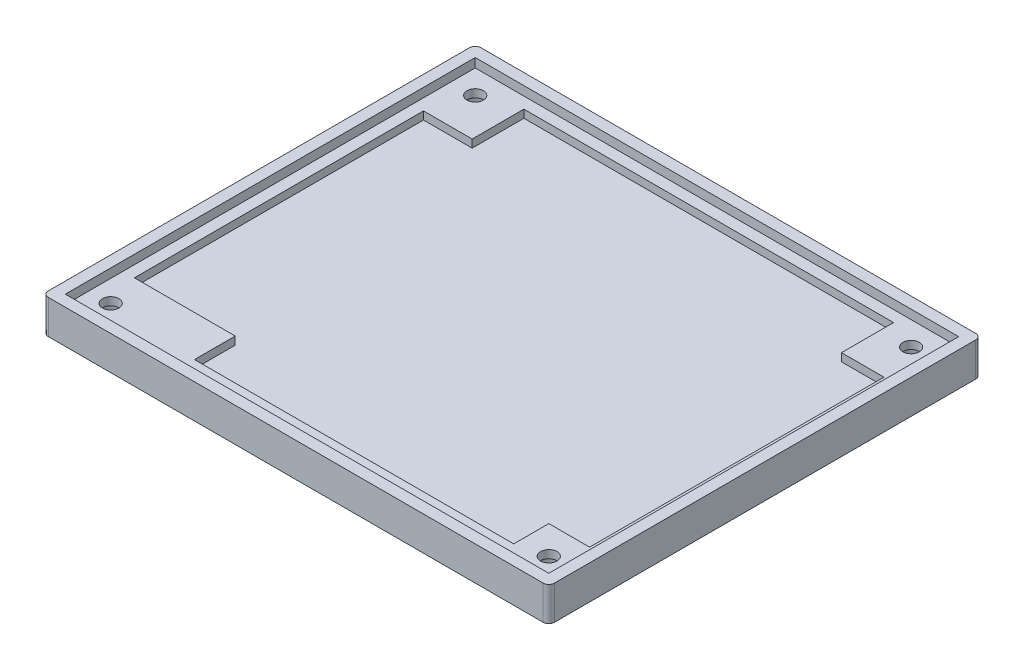
from build123d import *

# Parameters (mm, degrees)
SKETCH1_W           = 89.4
SKETCH1_H           = 76.4
BOSS_EXTRUDE1_DEPTH = 6
SKETCH1_5_W         = 85.4
SKETCH1_5_H         = 72.4
CUT_EXTRUDE2_DEPTH  = 1.6
CUT_EXTRUDE3_DEPTH  = 3
SKETCH1_7_R         = 1.45
CUT_EXTRUDE4_DEPTH  = 82.868794295
FILLET1_R           = 1
SKETCH2_R           = 3.5
CUT_EXTRUDE5_DEPTH  = 3


with BuildPart() as part:
    # Sketch1 → Boss-Extrude1 (new body)
    with BuildSketch(Plane(origin=(0, 0, 0), x_dir=(1, 0, 0), z_dir=(0, 1, 0))):
        with Locations((-24.890531337, 4.504302213)):
            Rectangle(SKETCH1_W, SKETCH1_H)
    extrude(amount=-BOSS_EXTRUDE1_DEPTH)

    # Sketch1<5> → Cut-Extrude2 (cut)
    with BuildSketch(Plane(origin=(0, 0, 0), x_dir=(1, 0, 0), z_dir=(0, 1, 0))):
        with Locations((-24.890531337, 4.504302213)):
            Rectangle(SKETCH1_5_W, SKETCH1_5_H)
    extrude(amount=-CUT_EXTRUDE2_DEPTH, mode=Mode.SUBTRACT)

    # Sketch1<6> → Cut-Extrude3 (cut)
    with BuildSketch(Plane(origin=(0, 0, 0), x_dir=(1, 0, 0), z_dir=(0, 1, 0))):
        Polygon((-47.775836727, -21.495697787), (-65.590531337, -21.495697787), (-65.590531337, 29.568169386), (-56.990531337, 29.568169386), (-56.990531337, 38.704302213), (8.309468663, 38.704302213), (8.309468663, 29.504302213), (15.809468663, 29.504302213), (15.809468663, -22.495697787), (8.609468663, -22.495697787), (8.609468663, -28.695697787), (-47.775836727, -28.695697787), align=None)
    extrude(amount=-CUT_EXTRUDE3_DEPTH, mode=Mode.SUBTRACT)

    # Sketch1<7> → Cut-Extrude4 (cut, through all)
    with BuildSketch(Plane(origin=(0, 0, 0), x_dir=(1, 0, 0), z_dir=(0, 1, 0))):
        with Locations((13.609468663, 36.504302213)):
            Circle(SKETCH1_7_R)
        with Locations((-63.775836727, -27.495697787)):
            Circle(SKETCH1_7_R)
        with Locations((-63.390531337, 36.504302213)):
            Circle(SKETCH1_7_R)
        with Locations((13.609468663, -27.495697787)):
            Circle(SKETCH1_7_R)
    extrude(amount=-CUT_EXTRUDE4_DEPTH, mode=Mode.SUBTRACT)

    # Fillet1
    fillet1_edges = [part.edges().sort_by_distance(p)[0] for p in [
        (-69.590531337, -3, 33.695697787),
        (-69.590531337, -3, -42.704302213),
        (19.809468663, -3, 33.695697787),
        (19.809468663, -3, -42.704302213),
    ]]
    fillet(fillet1_edges, radius=FILLET1_R)

    # Sketch2 → Cut-Extrude5 (cut)
    with BuildSketch(Plane.XZ.offset(6)):
        with Locations((-63.775836727, 27.495697787)):
            Circle(SKETCH2_R)
        with Locations((13.609468663, 27.495697787)):
            Circle(SKETCH2_R)
        with Locations((13.609468663, -36.504302213)):
            Circle(SKETCH2_R)
        with Locations((-63.390531337, -36.504302213)):
            Circle(SKETCH2_R)
    extrude(amount=-CUT_EXTRUDE5_DEPTH, mode=Mode.SUBTRACT)


solid = part.part
